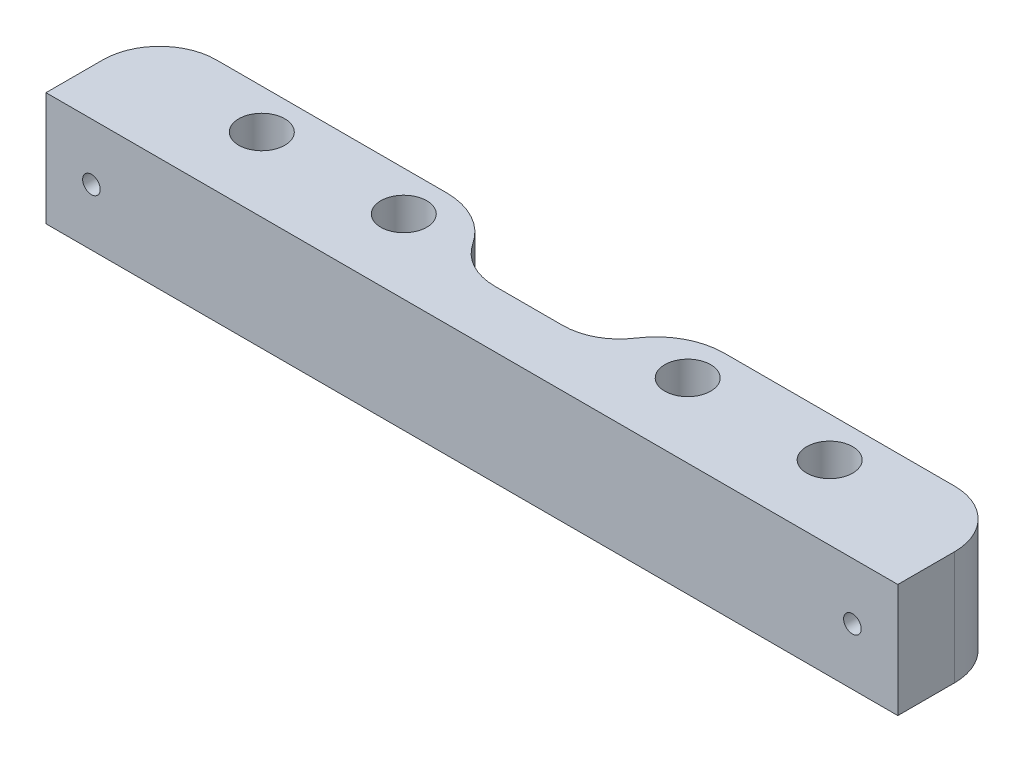
from build123d import *

# Parameters (mm, degrees)
SKETCH1_W           = 150
SKETCH1_H           = 20
SKETCH1_R           = 4.05
BOSS_EXTRUDE1_DEPTH = 20
FILLET1_R           = 10
SKETCH3_R           = 1.55
CUT_EXTRUDE1_DEPTH  = 81.156097709
SKETCH3_3_R         = 3.5
SKETCH3_3_R_2       = 1.55
CUT_EXTRUDE2_DEPTH  = 3
CUT_EXTRUDE3_DEPTH  = 79.262379347
FILLET2_R           = 12


with BuildPart() as part:
    # Sketch1 → Boss-Extrude1 (new body)
    with BuildSketch(Plane(origin=(0, 0, 0), x_dir=(1, 0, 0), z_dir=(0, 1, 0))):
        Rectangle(SKETCH1_W, SKETCH1_H)
        with Locations((-25, 3)):
            Circle(SKETCH1_R, mode=Mode.SUBTRACT)
        with Locations((25, 3)):
            Circle(SKETCH1_R, mode=Mode.SUBTRACT)
        with Locations((-50, 3)):
            Circle(SKETCH1_R, mode=Mode.SUBTRACT)
        with Locations((50, 3)):
            Circle(SKETCH1_R, mode=Mode.SUBTRACT)
    extrude(amount=BOSS_EXTRUDE1_DEPTH)

    # Fillet1
    fillet1_edges = [part.edges().sort_by_distance(p)[0] for p in [
        (75, 10, -10),
        (-75, 10, -10),
    ]]
    fillet(fillet1_edges, radius=FILLET1_R)

    # Sketch3 → Cut-Extrude1 (cut, through all)
    with BuildSketch(Plane(origin=(0, 0, -10), x_dir=(-1, 0, 0), z_dir=(0, 0, -1))):
        with Locations((-67, 10)):
            Circle(SKETCH3_R)
        with Locations((67, 10)):
            Circle(SKETCH3_R)
    extrude(amount=-CUT_EXTRUDE1_DEPTH, mode=Mode.SUBTRACT)

    # Sketch3<3> → Cut-Extrude2 (cut)
    # profile 1 of 2: a face of its own
    with BuildSketch(Plane(origin=(0, 0, -10), x_dir=(-1, 0, 0), z_dir=(0, 0, -1))):
        with Locations((-67, 10)):
            Circle(SKETCH3_3_R)
        with Locations((-67, 10)):
            Circle(SKETCH3_3_R_2, mode=Mode.SUBTRACT)
    # profile 2 of 2: a face of its own
    with BuildSketch(Plane(origin=(0, 0, -10), x_dir=(-1, 0, 0), z_dir=(0, 0, -1))):
        with Locations((67, 10)):
            Circle(SKETCH3_3_R)
        with Locations((67, 10)):
            Circle(SKETCH3_3_R_2, mode=Mode.SUBTRACT)
    extrude(amount=-CUT_EXTRUDE2_DEPTH, mode=Mode.SUBTRACT)

    # Sketch4 → Cut-Extrude3 (cut, through all)
    with BuildSketch(Plane(origin=(0, 20, 0), x_dir=(1, 0, 0), z_dir=(0, 1, 0))):
        with BuildLine():
            Line((-6, 20), (6, 20))
            ThreePointArc((6, 20), (16, 10), (6, 0))
            Line((6, 0), (-6, 0))
            ThreePointArc((-6, 0), (-16, 10), (-6, 20))
        make_face()
    extrude(amount=-CUT_EXTRUDE3_DEPTH, mode=Mode.SUBTRACT)

    # Fillet2
    fillet2_edges = [part.edges().sort_by_distance(p)[0] for p in [
        (16, 10, -10),
        (-16, 10, -10),
    ]]
    fillet(fillet2_edges, radius=FILLET2_R)


solid = part.part
